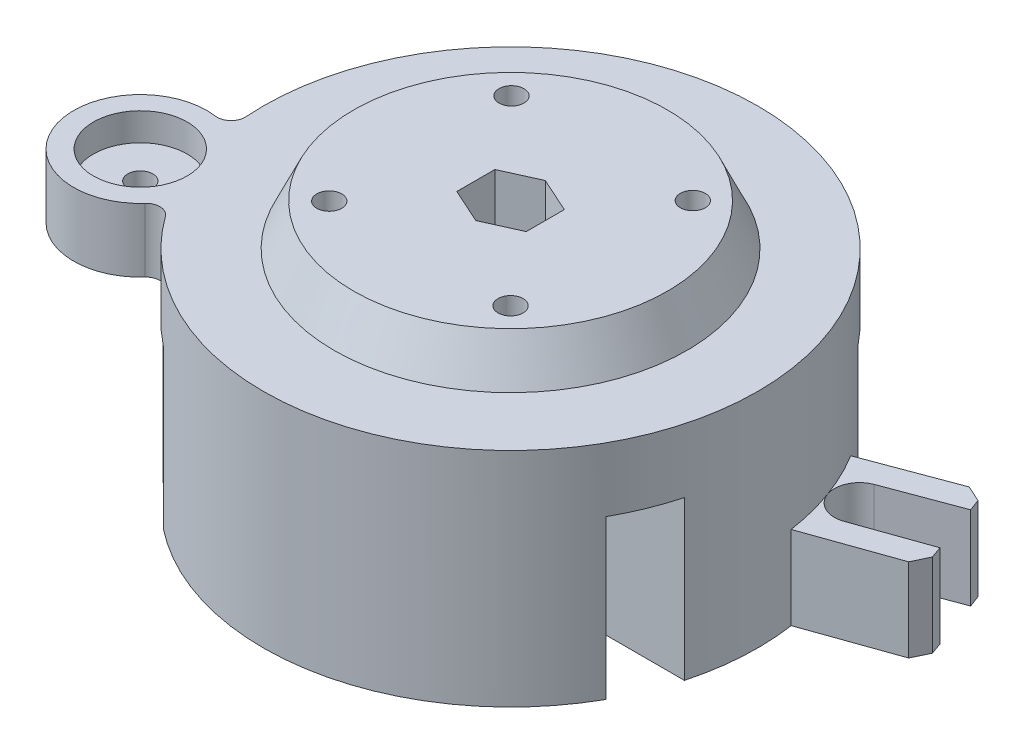
from build123d import *

# Parameters (mm, degrees)
SKETCH2_R           = 45.212
SKETCH2_R_2         = 32.258
BOSS_EXTRUDE3_DEPTH = 40.64
SKETCH4_R           = 32.258
BOSS_EXTRUDE4_DEPTH = 7.62
BOSS_EXTRUDE4_TAPER = 25
CUT_EXTRUDE1_DEPTH  = 81.10791158
SKETCH7_R           = 2.286
CUT_EXTRUDE2_DEPTH  = 81.107911519
BOSS_EXTRUDE8_START = -7.62
BOSS_EXTRUDE8_DEPTH = 11.684
SKETCH18_R          = 8.567257543
CUT_EXTRUDE3_DEPTH  = 5.08
SKETCH19_R          = 2.286
CUT_EXTRUDE4_DEPTH  = 85.454467418
BOSS_EXTRUDE9_START = -15.24
BOSS_EXTRUDE9_DEPTH = 15.24
CUT_EXTRUDE5_START  = -28.956
SKETCH21_R          = 2.286
CUT_EXTRUDE5_DEPTH  = 28.956
CIRPATTERN1_COUNT   = 2


with BuildPart() as part:
    # Sketch2 → Boss-Extrude3 (new body)
    # profile 1 of 2: a face of its own
    with BuildSketch(Plane(origin=(0, 0, 0), x_dir=(1, 0, 0), z_dir=(0, 1, 0))):
        with Locations(Location((0, 0, 0), (0, 0, 270))):
            Circle(SKETCH2_R)
        Circle(SKETCH2_R_2, mode=Mode.SUBTRACT)
    # profile 2 of 2: a face of its own
    with BuildSketch(Plane(origin=(0, 0, 0), x_dir=(1, 0, 0), z_dir=(0, 1, 0))):
        Circle(SKETCH2_R_2)
        Polygon((0, 6.35), (-6.35, 3.483506942), (-6.35, -3.483506942), (0, -6.35), (6.35, -3.483506942), (6.35, 3.483506942), align=None, mode=Mode.SUBTRACT)
    extrude(amount=-BOSS_EXTRUDE3_DEPTH)

    # Sketch4 → Boss-Extrude4 (add)
    with BuildSketch(Plane(origin=(0, 0, 0), x_dir=(1, 0, 0), z_dir=(0, 1, 0))):
        Circle(SKETCH4_R)
    extrude(amount=BOSS_EXTRUDE4_DEPTH, taper=BOSS_EXTRUDE4_TAPER)

    # Sketch6 → Cut-Extrude1 (cut, through all)
    with BuildSketch(Plane(origin=(0, -40.64, 0), x_dir=(-1, 0, 0), z_dir=(0, -1, 0))):
        Polygon((6.35, -3.483506942), (0, -6.35), (-6.35, -3.483506942), (-6.35, 3.483506942), (0, 6.35), (6.35, 3.483506942), align=None)
    extrude(amount=-CUT_EXTRUDE1_DEPTH, mode=Mode.SUBTRACT)

    # Sketch7 → Cut-Extrude2 (cut, through all)
    with BuildSketch(Plane(origin=(0, 7.62, 0), x_dir=(1, 0, 0), z_dir=(0, 1, 0))):
        with Locations(Location((-16.495222192, 16.6624, 0), (0, 0, 270))):
            Circle(SKETCH7_R)
        with Locations(Location((16.6624, 16.6624, 0), (0, 0, 270))):
            Circle(SKETCH7_R)
        with Locations(Location((16.6624, -16.6624, 0), (0, 0, 270))):
            Circle(SKETCH7_R)
        with Locations(Location((-16.495222192, -16.6624, 0), (0, 0, 270))):
            Circle(SKETCH7_R)
    extrude(amount=-CUT_EXTRUDE2_DEPTH, mode=Mode.SUBTRACT)

    # Sketch12 → Boss-Extrude8 (add)
    with BuildSketch(Plane(origin=(0, 7.62, 0), x_dir=(1, 0, 0), z_dir=(0, 1, 0)).offset(BOSS_EXTRUDE8_START)):
        with BuildLine():
            ThreePointArc((-45.091998917, -3.291895759), (-45.888251869, -5.330050438), (-47.973633707, -5.992829324))
            ThreePointArc((-47.973633707, -5.992829324), (-61.102572974, -22.2395178), (-40.602051954, -26.246083736))
            ThreePointArc((-40.602051954, -26.246083736), (-38.578530729, -25.413344212), (-36.658465006, -26.462839746))
            ThreePointArc((-36.658465006, -26.462839746), (-42.485382771, -15.46341472), (-45.091998917, -3.291895759))
        make_face()
    extrude(amount=-BOSS_EXTRUDE8_DEPTH)

    # Sketch18 → Cut-Extrude3 (cut)
    with BuildSketch(Plane(origin=(0, 0, 0), x_dir=(1, 0, 0), z_dir=(0, 1, 0))):
        with Locations(Location((-49.645840541, -18.069608212, 0), (0, 0, 270))):
            Circle(SKETCH18_R)
    extrude(amount=-CUT_EXTRUDE3_DEPTH, mode=Mode.SUBTRACT)

    # Sketch19 → Cut-Extrude4 (cut, through all)
    with BuildSketch(Plane(origin=(0, -5.08, 0), x_dir=(1, 0, 0), z_dir=(0, 1, 0))):
        with Locations(Location((-49.645840541, -18.069608212, 0), (0, 0, 270))):
            Circle(SKETCH19_R)
    extrude(amount=-CUT_EXTRUDE4_DEPTH, mode=Mode.SUBTRACT)

    # Sketch20 → Boss-Extrude9 (add)
    with BuildSketch(Plane.XZ.offset(40.64).offset(BOSS_EXTRUDE9_START)):
        with BuildLine():
            ThreePointArc((42.485382852, -15.463414497), (44.831385262, -12.89196184), (48.307822394, -12.717373918))
            Line((48.307822394, -12.717373918), (61.237093085, -17.295868799))
            Line((61.237093085, -17.295868799), (62.000175566, -15.140990351))
            Line((62.000175566, -15.140990351), (60.601893265, -12.209430544))
            Line((60.601893265, -12.209430544), (44.72934622, -6.588666841))
            ThreePointArc((44.72934622, -6.588666841), (43.832551012, -11.082978649), (42.485382852, -15.463414497))
        make_face()
        with BuildLine():
            ThreePointArc((45.180509286, -21.309596065), (42.629626793, -18.941243028), (42.485382852, -15.463414497))
            ThreePointArc((42.485382852, -15.463414497), (40.701683588, -19.684966271), (38.499780526, -23.704257918))
            Line((38.499780526, -23.704257918), (54.271814253, -29.601179693))
            Line((54.271814253, -29.601179693), (57.22733096, -28.254273131))
            Line((57.22733096, -28.254273131), (58.027905034, -26.113040506))
            Line((58.027905034, -26.113040506), (45.180509286, -21.309596065))
        make_face()
    extrude(amount=BOSS_EXTRUDE9_DEPTH)

    # Sketch21 → Cut-Extrude5 (cut)
    # profile 1 of 2: a face of its own
    with BuildSketch(Plane.XZ.offset(40.64).offset(CUT_EXTRUDE5_START)):
        with BuildLine():
            Line((-20.08732464, 27.438707345), (-28.082012675, 35.43339538))
            ThreePointArc((-28.082012675, 35.43339538), (-31.885487137, 32.053715136), (-35.285134805, 28.268077504))
            Line((-35.285134805, 28.268077504), (-27.271504992, 20.254502449))
            Line((-27.271504992, 20.254502449), (-30.86360744, 16.662375455))
            Line((-30.86360744, 16.662375455), (-23.679427089, 9.478195103))
            ThreePointArc((-23.679427089, 9.478195103), (-9.311017295, 9.478195103), (-9.311017295, 23.846604897))
            Line((-9.311017295, 23.846604897), (-16.495222192, 31.030809794))
            Line((-16.495222192, 31.030809794), (-20.08732464, 27.438707345))
        make_face()
        with Locations(Location((-16.495222192, 16.6624, 0), (0, 0, 90))):
            Circle(SKETCH21_R, mode=Mode.SUBTRACT)
    # profile 2 of 2: a face of its own
    with BuildSketch(Plane.XZ.offset(40.64).offset(CUT_EXTRUDE5_START)):
        with BuildLine():
            ThreePointArc((16.6624, 26.8224), (6.5024, 16.6624), (16.6624, 6.5024))
            Line((16.6624, 6.5024), (26.8224, 6.5024))
            Line((26.8224, 6.5024), (26.8224, 11.844066963))
            Line((26.8224, 11.844066963), (43.63304965, 11.844066963))
            ThreePointArc((43.63304965, 11.844066963), (41.873887087, 17.050000709), (39.496151472, 22.004066963))
            Line((39.496151472, 22.004066963), (25.304864582, 22.004066963))
            Line((25.304864582, 22.004066963), (25.304864582, 26.8224))
            Line((25.304864582, 26.8224), (16.6624, 26.8224))
        make_face()
        with Locations(Location((16.6624, 16.6624, 0), (0, 0, 90))):
            Circle(SKETCH21_R, mode=Mode.SUBTRACT)
    cut_extrude5 = extrude(amount=CUT_EXTRUDE5_DEPTH, mode=Mode.SUBTRACT)

    # CirPattern1: Cut-Extrude5 ×2 about axis
    cirpattern1_axis = Axis((0, 0, 0), (0, 1, 0))
    for i in range(1, CIRPATTERN1_COUNT):
        add(cut_extrude5.rotate(cirpattern1_axis, i * 360 / CIRPATTERN1_COUNT), mode=Mode.SUBTRACT)


solid = part.part
